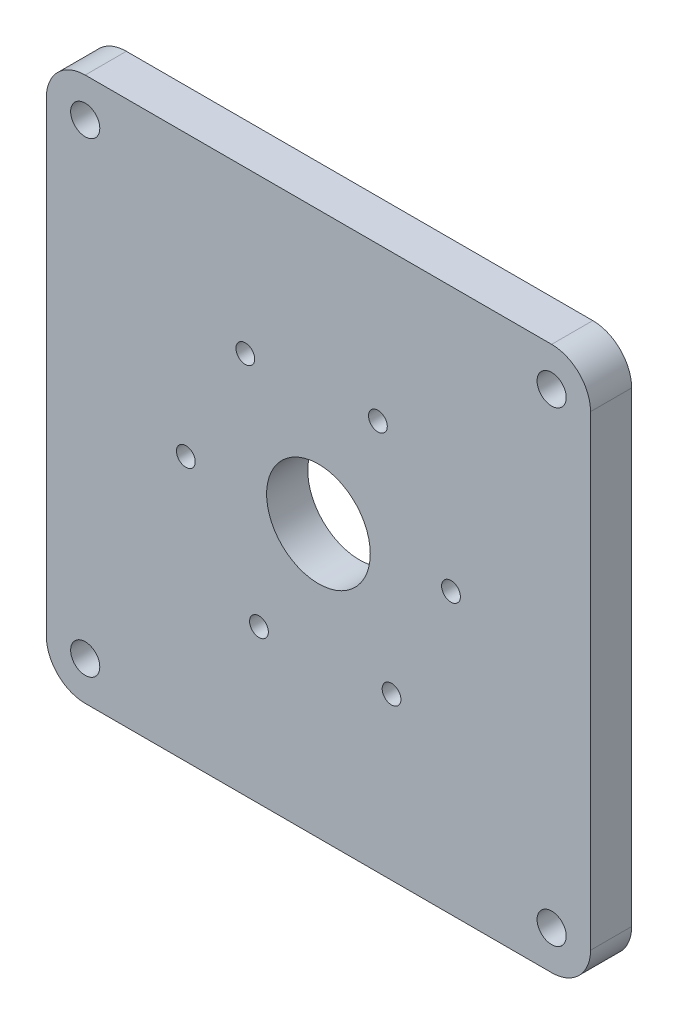
from build123d import *

# Parameters (mm, degrees)
PLACA_SOPORTE_M1_START             = 36.5
PLACA_SOPORTE_M1_DEPTH             = 6.35
BARRENOS_SEPARADORES_Y_MOTOR_START = 36.5
CROQUIS2_R                         = 2.25
CROQUIS2_R_2                       = 1.45
CROQUIS2_R_3                       = 8
BARRENOS_SEPARADORES_Y_MOTOR_DEPTH = 6.35
REFRENTADO_M2_5_START              = 36.5
CROQUIS3_R                         = 2.5
REFRENTADO_M2_5_DEPTH              = 2.6


with BuildPart() as part:
    # Croquis1 → Placa_soporte_M1 (new body)
    with BuildSketch(Plane.XY.offset(PLACA_SOPORTE_M1_START)):
        with BuildLine():
            Line((-36, -42), (36, -42))
            ThreePointArc((36, -42), (40.242640687, -40.242640687), (42, -36))
            Line((42, -36), (42, 36))
            ThreePointArc((42, 36), (40.242640687, 40.242640687), (36, 42))
            Line((36, 42), (-36, 42))
            ThreePointArc((-36, 42), (-40.242640687, 40.242640687), (-42, 36))
            Line((-42, 36), (-42, -36))
            ThreePointArc((-42, -36), (-40.242640687, -40.242640687), (-36, -42))
        make_face()
    extrude(amount=PLACA_SOPORTE_M1_DEPTH)

    # Croquis2 → Barrenos_separadores_y_motor (cut)
    with BuildSketch(Plane.XY.offset(BARRENOS_SEPARADORES_Y_MOTOR_START)):
        with Locations((-36, -36)):
            Circle(CROQUIS2_R)
        with Locations((-36, 36)):
            Circle(CROQUIS2_R)
        with Locations((36, -36)):
            Circle(CROQUIS2_R)
        with Locations((36, 36)):
            Circle(CROQUIS2_R)
        with Locations((20.463916472, 1.215780658)):
            Circle(CROQUIS2_R_2)
        with Locations((9.179061301, 18.330161855)):
            Circle(CROQUIS2_R_2)
        with Locations((-11.284855172, 17.114381197)):
            Circle(CROQUIS2_R_2)
        with Locations((-20.463916472, -1.215780658)):
            Circle(CROQUIS2_R_2)
        with Locations((-9.179061301, -18.330161855)):
            Circle(CROQUIS2_R_2)
        with Locations((11.284855172, -17.114381197)):
            Circle(CROQUIS2_R_2)
        Circle(CROQUIS2_R_3)
    extrude(amount=BARRENOS_SEPARADORES_Y_MOTOR_DEPTH, mode=Mode.SUBTRACT)

    # Croquis3 → Refrentado_M2-5 (cut)
    with BuildSketch(Plane.XY.offset(REFRENTADO_M2_5_START)):
        with Locations((20.463916472, 1.215780658)):
            Circle(CROQUIS3_R)
        with Locations((9.179061301, 18.330161855)):
            Circle(CROQUIS3_R)
        with Locations((-11.284855172, 17.114381197)):
            Circle(CROQUIS3_R)
        with Locations((-20.463916472, -1.215780658)):
            Circle(CROQUIS3_R)
        with Locations((-9.179061301, -18.330161855)):
            Circle(CROQUIS3_R)
        with Locations((11.284855172, -17.114381197)):
            Circle(CROQUIS3_R)
    extrude(amount=REFRENTADO_M2_5_DEPTH, mode=Mode.SUBTRACT)


solid = part.part
